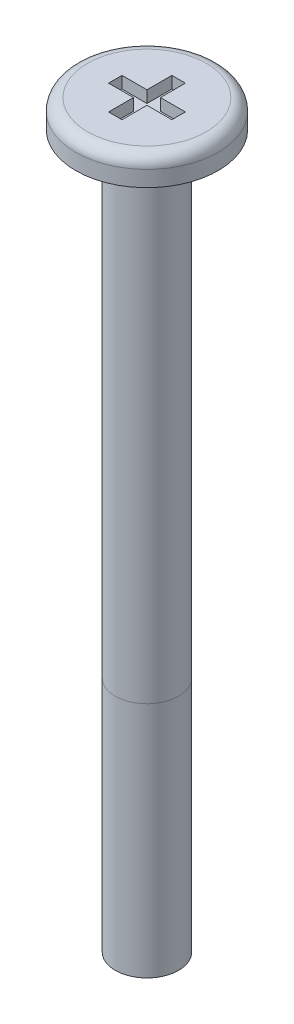
from build123d import *

# Parameters (mm, degrees)
SKETCH3_R           = 2
BOSS_EXTRUDE1_DEPTH = 45
SKETCH4_R           = 4.5
BOSS_EXTRUDE2_DEPTH = 1.75
FILLET3_R           = 0.75
CUT_EXTRUDE4_DEPTH  = 0.75


with BuildPart() as part:
    # Sketch3 → Boss-Extrude1 (new body)
    with BuildSketch(Plane(origin=(0, 0, 0), x_dir=(1, 0, 0), z_dir=(0, 1, 0))):
        with Locations(Location((0, 0, 0), (0, 0, 90))):
            Circle(SKETCH3_R)
    extrude(amount=BOSS_EXTRUDE1_DEPTH)

    # Sketch4 → Boss-Extrude2 (add)
    with BuildSketch(Plane(origin=(0, 45, 0), x_dir=(1, 0, 0), z_dir=(0, 1, 0))):
        with Locations(Location((0, 0, 0), (0, 0, 270))):
            Circle(SKETCH4_R)
    extrude(amount=BOSS_EXTRUDE2_DEPTH)

    # Fillet3
    fillet3_edges = [part.edges().sort_by_distance(p)[0] for p in [
        (0, 46.75, -4.5),
    ]]
    fillet(fillet3_edges, radius=FILLET3_R)

    # Sketch6 → Cut-Extrude4 (cut)
    with BuildSketch(Plane(origin=(0, 46.75, 0), x_dir=(1, 0, 0), z_dir=(0, 1, 0))):
        Polygon((0.425, 0.425), (2, 0.425), (2, -0.425), (0.425, -0.425), (0.425, -2), (-0.425, -2), (-0.425, -0.425), (-2, -0.425), (-2, 0.425), (-0.425, 0.425), (-0.425, 2), (0.425, 2), align=None)
    extrude(amount=-CUT_EXTRUDE4_DEPTH, mode=Mode.SUBTRACT)


solid = part.part
